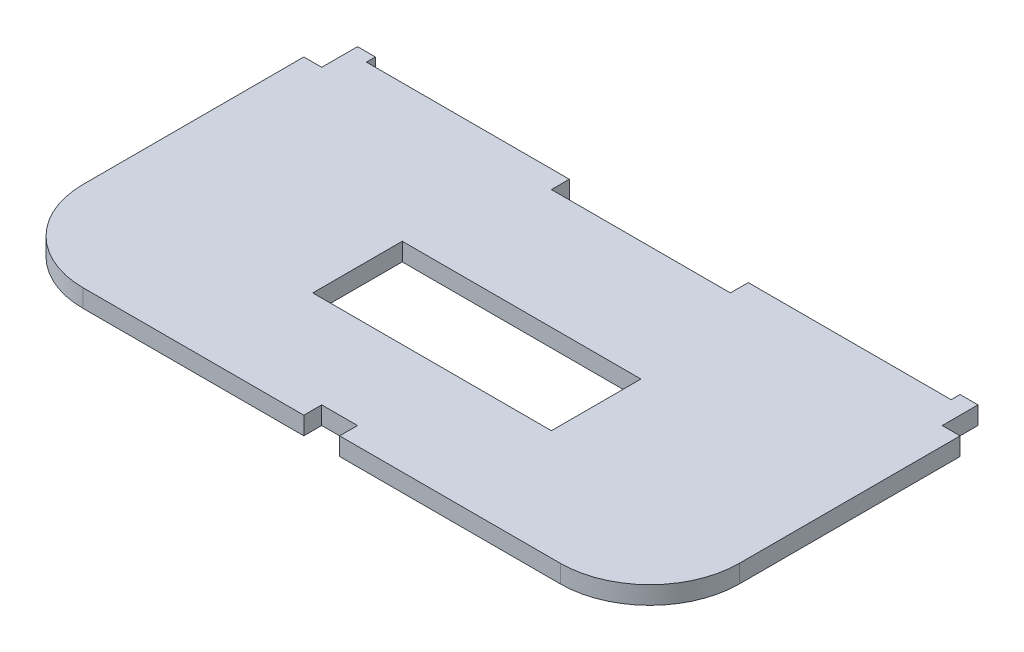
from build123d import *

# Parameters (mm, degrees)
SKETCH_3_W      = 40
SKETCH_3_H      = 15
EXTRUDE_2_DEPTH = 3
FILLET1_R       = 15


with BuildPart() as part:
    # Эскиз3 → Бобышка-Вытянуть2 (new body)
    with BuildSketch(Plane(origin=(0, 0, 0), x_dir=(1, 0, 0), z_dir=(0, 1, 0))):
        Polygon((0, 52), (3, 52), (3, 58), (6, 58), (6, 56.5), (40, 56.5), (40, 53.5), (70, 53.5), (70, 56.5), (104, 56.5), (104, 58), (107, 58), (107, 52), (110, 52), (110, 0), (58, 0), (58, 3), (55, 3), (52, 3), (52, 0), (0, 0), align=None)
        with Locations((55, 26)):
            Rectangle(SKETCH_3_W, SKETCH_3_H, mode=Mode.SUBTRACT)
    extrude(amount=EXTRUDE_2_DEPTH)

    # Fillet1
    fillet1_edges = [part.edges().sort_by_distance(p)[0] for p in [
        (110, 1.5, 0),
        (0, 1.5, 0),
    ]]
    fillet(fillet1_edges, radius=FILLET1_R)


solid = part.part
